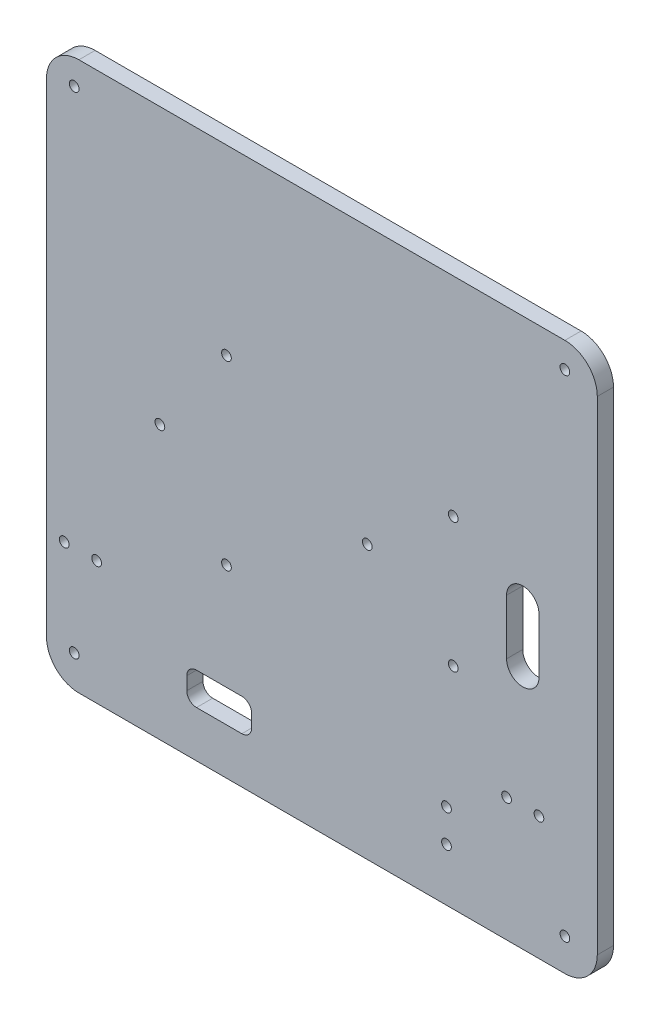
from build123d import *

# Parameters (mm, degrees)
SKETCH1_R           = 1.5
BOSS_EXTRUDE1_DEPTH = 5


with BuildPart() as part:
    # Sketch1 → Boss-Extrude1 (new body)
    with BuildSketch(Plane.XY):
        with BuildLine():
            Line((-75, -84.27), (75, -84.27))
            ThreePointArc((75, -84.27), (82.071067812, -81.341067812), (85, -74.27))
            Line((85, -74.27), (85, 75))
            ThreePointArc((85, 75), (82.071067812, 82.071067812), (75, 85))
            Line((75, 85), (-75, 85))
            ThreePointArc((-75, 85), (-82.071067812, 82.071067812), (-85, 75))
            Line((-85, 75), (-85, -74.27))
            ThreePointArc((-85, -74.27), (-82.071067812, -81.341067812), (-75, -84.27))
        make_face()
        with Locations((-50, 0)):
            Circle(SKETCH1_R, mode=Mode.SUBTRACT)
        with Locations((14, 0)):
            Circle(SKETCH1_R, mode=Mode.SUBTRACT)
        with Locations((56.997765234, -46.145194914)):
            Circle(SKETCH1_R, mode=Mode.SUBTRACT)
        with Locations((66.997765234, -46.145194914)):
            Circle(SKETCH1_R, mode=Mode.SUBTRACT)
        with Locations((-79.533394359, -46.145194914)):
            Circle(SKETCH1_R, mode=Mode.SUBTRACT)
        with Locations((-69.533394359, -46.145194914)):
            Circle(SKETCH1_R, mode=Mode.SUBTRACT)
        with Locations((38.452124501, -68)):
            Circle(SKETCH1_R, mode=Mode.SUBTRACT)
        with Locations((38.452124501, -58)):
            Circle(SKETCH1_R, mode=Mode.SUBTRACT)
        with Locations((75, -74.271781408)):
            Circle(SKETCH1_R, mode=Mode.SUBTRACT)
        with Locations((-76.456437184, -74.271781408)):
            Circle(SKETCH1_R, mode=Mode.SUBTRACT)
        with Locations((-76.456437184, 77.184655776)):
            Circle(SKETCH1_R, mode=Mode.SUBTRACT)
        with Locations((75, 77.184655776)):
            Circle(SKETCH1_R, mode=Mode.SUBTRACT)
        with Locations((40.5412515, 20.733071637)):
            Circle(SKETCH1_R, mode=Mode.SUBTRACT)
        with Locations((-29.453201544, -27.275016672)):
            Circle(SKETCH1_R, mode=Mode.SUBTRACT)
        with Locations((40.545873573, -19.266928096)):
            Circle(SKETCH1_R, mode=Mode.SUBTRACT)
        with Locations((-29.459672448, 28.724982955)):
            Circle(SKETCH1_R, mode=Mode.SUBTRACT)
        with BuildLine():
            Line((-38.703750493, -60), (-24.703750493, -60))
            ThreePointArc((-24.703750493, -60), (-22.58243015, -60.878679656), (-21.703750493, -63))
            Line((-21.703750493, -63), (-21.703750493, -67))
            ThreePointArc((-21.703750493, -67), (-22.58243015, -69.121320344), (-24.703750493, -70))
            Line((-24.703750493, -70), (-38.703750493, -70))
            ThreePointArc((-38.703750493, -70), (-40.825070837, -69.121320344), (-41.703750493, -67))
            Line((-41.703750493, -67), (-41.703750493, -63))
            ThreePointArc((-41.703750493, -63), (-40.825070837, -60.878679656), (-38.703750493, -60))
        make_face(mode=Mode.SUBTRACT)
        with BuildLine():
            Line((66.997765234, 7.870773212), (66.997765234, -9.129226788))
            ThreePointArc((66.997765234, -9.129226788), (61.997765234, -14.129226788), (56.997765234, -9.129226788))
            Line((56.997765234, -9.129226788), (56.997765234, 7.870773212))
            ThreePointArc((56.997765234, 7.870773212), (61.997765234, 12.870773212), (66.997765234, 7.870773212))
        make_face(mode=Mode.SUBTRACT)
    extrude(amount=BOSS_EXTRUDE1_DEPTH)


solid = part.part
